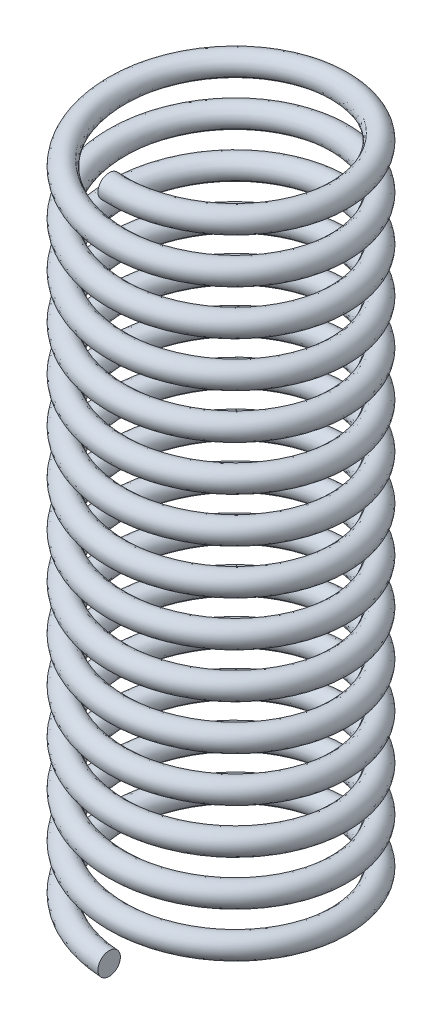
from build123d import *

# Parameters (mm, degrees)
BARRER1_PITCH  = 10
BARRER1_HEIGHT = 150
BARRER1_RADIUS = 25
CROQUIS2_R     = 2.5


with BuildPart() as part:
    # Barrer1: sweep along a helix
    with BuildLine() as barrer1_path:
        Helix(BARRER1_PITCH, BARRER1_HEIGHT, BARRER1_RADIUS, center=(0, 0, 0), direction=(0, 1, 0), lefthand=True)
    # Croquis2 → Barrer1 (sweep)
    with BuildSketch(Plane(origin=(0, 0, 0), x_dir=(0, 0, -1), z_dir=(1, 0, 0))):
        with Locations((-24.900742158, 149.858605573)):
            Circle(CROQUIS2_R)
    sweep(path=barrer1_path.line, is_frenet=True)


solid = part.part
